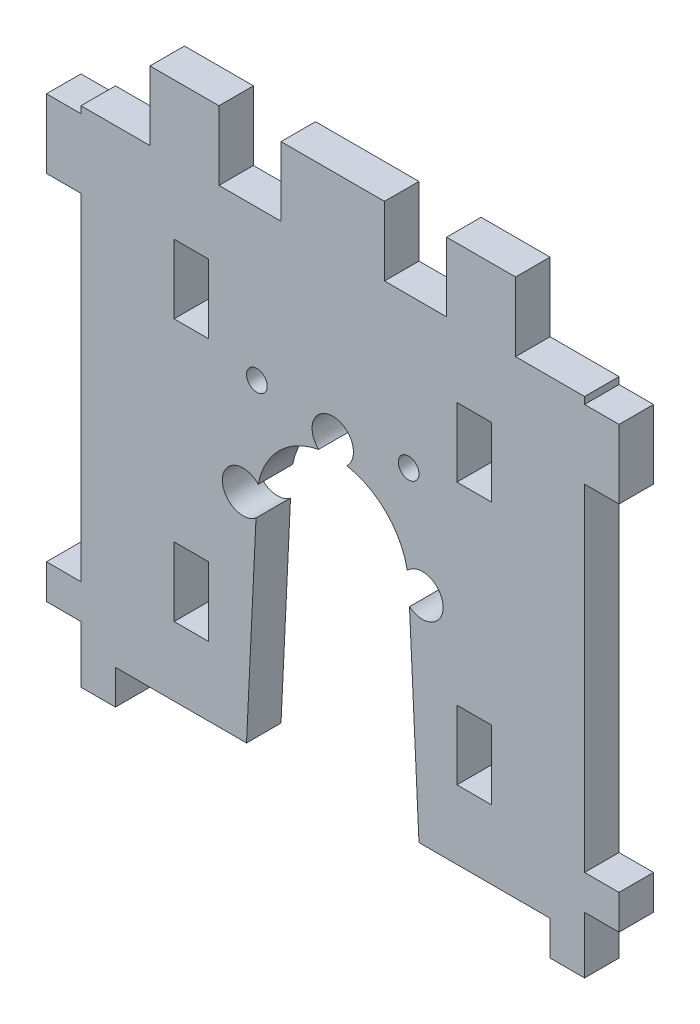
from build123d import *

# Parameters (mm, degrees)
BOSS_EXTRU_1_DEPTH      = 5
ESQUISSE3_R             = 3
ESQUISSE3_W             = 5
ESQUISSE3_H             = 48.75
ESQUISSE3_H_2           = 3.25
ESQUISSE3_H_3           = 10
ESQUISSE3_W_2           = 9
ESQUISSE3_H_4           = 5
ENL_V_MAT_EXTRU_1_DEPTH = 5
ESQUISSE4_W             = 10
ESQUISSE4_H             = 5
ESQUISSE4_W_2           = 15
ESQUISSE4_W_3           = 5
BOSS_EXTRU_2_DEPTH      = 5
ESQUISSE5_R             = 1.5
ENL_V_MAT_EXTRU_2_DEPTH = 5


with BuildPart() as part:
    # Esquisse1 → Boss.-Extru.1 (new body)
    with BuildSketch(Plane.XY):
        with BuildLine():
            Line((0, 0), (29, 0))
            Line((29, 0), (30.512421766, 31.797613203))
            ThreePointArc((30.512421766, 31.797613203), (41.5, 42.275), (52.487578234, 31.797613203))
            Line((52.487578234, 31.797613203), (54, 0))
            Line((54, 0), (83, 0))
            Line((83, 0), (83, 73))
            Line((83, 73), (0, 73))
            Line((0, 73), (0, 0))
        make_face()
    extrude(amount=BOSS_EXTRU_1_DEPTH)

    # Esquisse3 → Enlèv. mat.-Extru.1 (cut)
    with BuildSketch(Plane.XY.offset(5)):
        with Locations((41.5, 44.275)):
            Circle(ESQUISSE3_R)
        with Locations((54.5, 31.275)):
            Circle(ESQUISSE3_R)
        with Locations((28.5, 31.275)):
            Circle(ESQUISSE3_R)
        Polygon((15, 73), (0, 73), (0, 67), (5, 67), (5, 68), (15, 68), align=None)
        Polygon((78, 67), (83, 67), (83, 73), (68, 73), (68, 68), (78, 68), align=None)
        with Locations((2.5, 32.625)):
            Rectangle(ESQUISSE3_W, ESQUISSE3_H)
        with Locations((2.5, 1.625)):
            Rectangle(ESQUISSE3_W, ESQUISSE3_H_2)
        with Locations((80.5, 1.625)):
            Rectangle(ESQUISSE3_W, ESQUISSE3_H_2)
        with Locations((80.5, 32.625)):
            Rectangle(ESQUISSE3_W, ESQUISSE3_H)
        with Locations((62, 15)):
            Rectangle(ESQUISSE3_W, ESQUISSE3_H_3)
        with Locations((21, 53)):
            Rectangle(ESQUISSE3_W, ESQUISSE3_H_3)
        with Locations((21, 15)):
            Rectangle(ESQUISSE3_W, ESQUISSE3_H_3)
        with Locations((62, 53)):
            Rectangle(ESQUISSE3_W, ESQUISSE3_H_3)
        with Locations((53.5, 70.5)):
            Rectangle(ESQUISSE3_W_2, ESQUISSE3_H_4)
        with Locations((29.5, 70.5)):
            Rectangle(ESQUISSE3_W_2, ESQUISSE3_H_4)
    extrude(amount=-ENL_V_MAT_EXTRU_1_DEPTH, mode=Mode.SUBTRACT)

    # Esquisse4 → Boss.-Extru.2 (add)
    with BuildSketch(Plane(origin=(0, 0, 0), x_dir=(-1, 0, 0), z_dir=(0, 0, -1))):
        with Locations((-63, 75.5)):
            Rectangle(ESQUISSE4_W, ESQUISSE4_H)
        with Locations((-41.5, 75.5)):
            Rectangle(ESQUISSE4_W_2, ESQUISSE4_H)
        with Locations((-20, 75.5)):
            Rectangle(ESQUISSE4_W, ESQUISSE4_H)
        with Locations((-75.5, -2.5)):
            Rectangle(ESQUISSE4_W_3, ESQUISSE4_H)
        with Locations((-7.5, -2.5)):
            Rectangle(ESQUISSE4_W_3, ESQUISSE4_H)
    extrude(amount=-BOSS_EXTRU_2_DEPTH)

    # Esquisse5 → Enlèv. mat.-Extru.2 (cut)
    with BuildSketch(Plane.XY.offset(5)):
        with Locations((52.5, 46.275)):
            Circle(ESQUISSE5_R)
        with Locations((30.5, 46.275)):
            Circle(ESQUISSE5_R)
    extrude(amount=-ENL_V_MAT_EXTRU_2_DEPTH, mode=Mode.SUBTRACT)


solid = part.part
